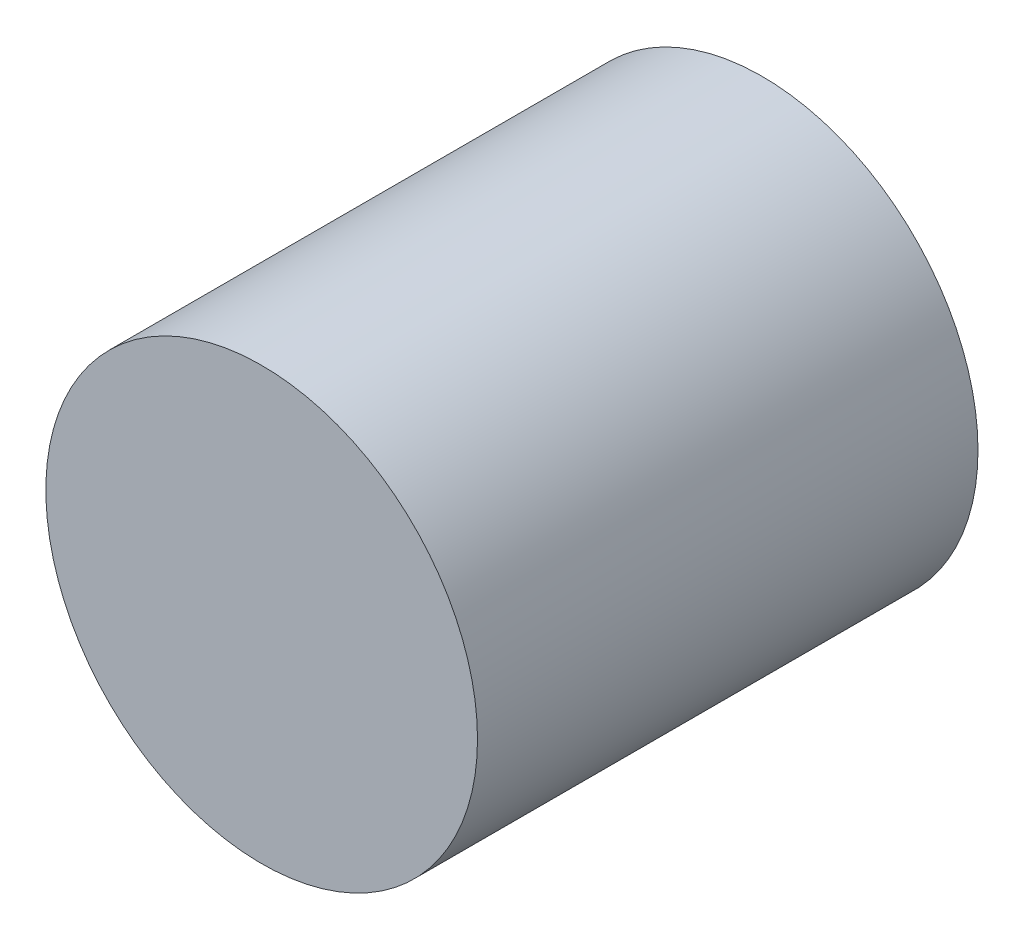
from build123d import *

# Parameters (mm, degrees)
SKETCH1_R           = 1.7526
BOSS_EXTRUDE1_DEPTH = 4.064


with BuildPart() as part:
    # Sketch1 → Boss-Extrude1 (new body)
    with BuildSketch(Plane.XY):
        Circle(SKETCH1_R)
    extrude(amount=BOSS_EXTRUDE1_DEPTH)


solid = part.part
